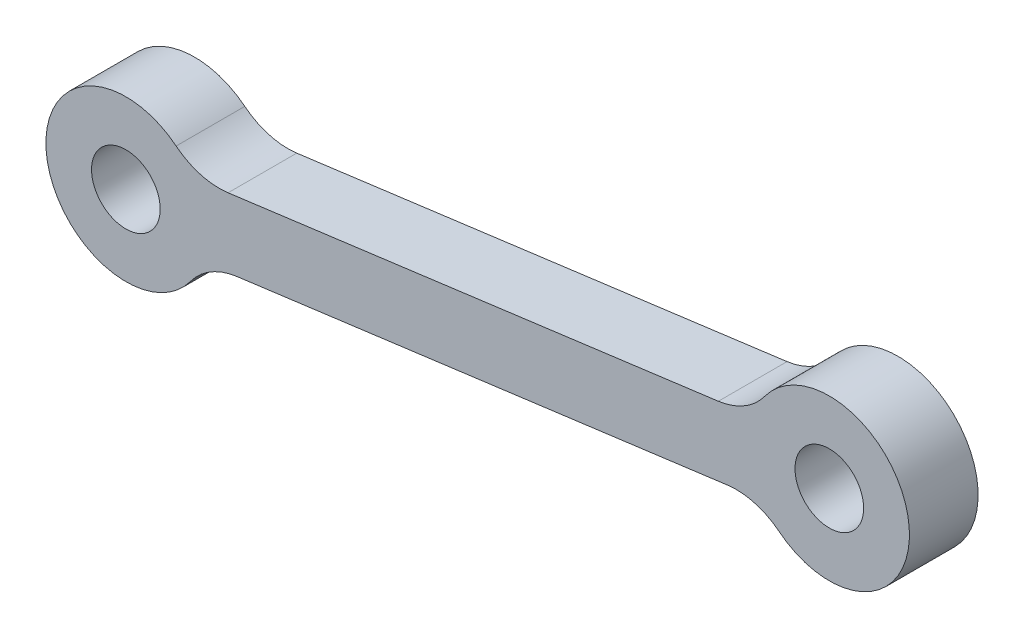
from build123d import *

# Parameters (mm, degrees)
SKETCH1_R           = 1.5
BOSS_EXTRUDE1_DEPTH = 3
FILLET1_R           = 3
SCALE1_SCALE        = 1.9


with BuildPart() as part:
    # Sketch1 → Boss-Extrude1 (new body)
    with BuildSketch(Plane.XY):
        with BuildLine():
            Line((2.948464825, 1.901558102), (27.398838387, 5.123947068))
            ThreePointArc((27.398838387, 5.123947068), (34.199993873, 4.507321028), (27.790827839, 2.149666606))
            Line((27.790827839, 2.149666606), (3.336427979, -1.073252998))
            ThreePointArc((3.336427979, -1.073252998), (-3.463886078, -0.447419324), (2.948464825, 1.901558102))
        make_face()
        Circle(SKETCH1_R, mode=Mode.SUBTRACT)
        with Locations((30.73, 4.05)):
            Circle(SKETCH1_R, mode=Mode.SUBTRACT)
    extrude(amount=-BOSS_EXTRUDE1_DEPTH)

    # Fillet1
    fillet1_edges = [part.edges().sort_by_distance(p)[0] for p in [
        (3.336427979, -1.073252998, -1.5),
        (2.948464825, 1.901558102, -1.5),
        (27.398838387, 5.123947068, -1.5),
        (27.790827839, 2.149666606, -1.5),
    ]]
    fillet(fillet1_edges, radius=FILLET1_R)


with BuildPart() as part_1:
    # Scale1: scaled about (15.368858916, 2.026731994, -1.5)
    add(part.part.scale(SCALE1_SCALE).moved(Location((-13.831973024, -1.824058795, 1.35))))


solid = part_1.part
